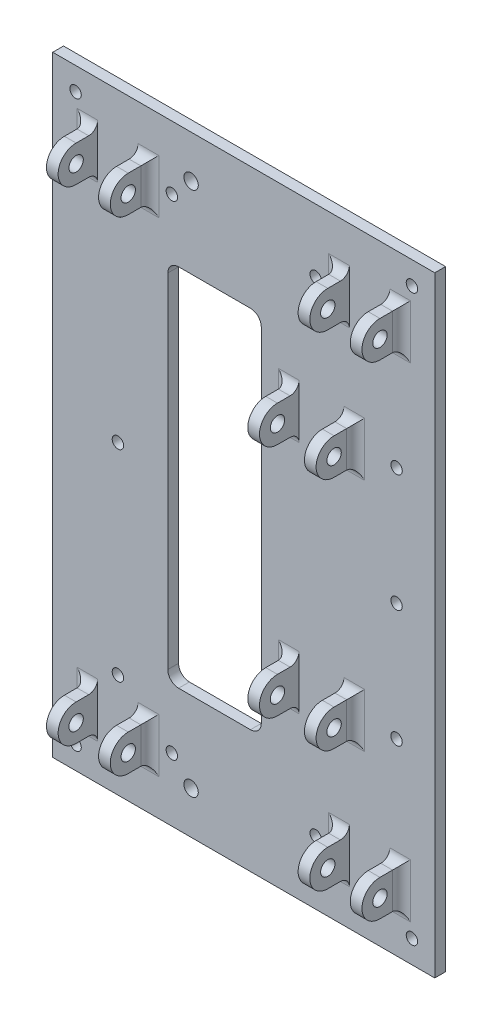
from build123d import *

# Parameters (mm, degrees)
SKETCH1_W               = 212.5
SKETCH1_H               = 339.725
BOSS_EXTRUDE1_DEPTH     = 6
SKETCH2_W               = 6.5
SKETCH2_H               = 20
BOSS_EXTRUDE2_DEPTH     = 24
CUT_EXTRUDE1_DEPTH      = 393.36344838
CUT_EXTRUDE1_DEPTH_BACK = 393.36344838
SKETCH3_R               = 4
FILLET2_R               = 5
SKETCH5_R               = 3.175
CUT_EXTRUDE2_DEPTH      = 402.314497153
CUT_EXTRUDE3_DEPTH      = 402.314497153
SKETCH10_R              = 4
CUT_EXTRUDE4_DEPTH      = 18
SKETCH11_R              = 4
CUT_EXTRUDE5_DEPTH      = 14.986


with BuildPart() as part:
    # Sketch1 → Boss-Extrude1 (new body)
    with BuildSketch(Plane.XY):
        with Locations((106.25, -169.8625)):
            Rectangle(SKETCH1_W, SKETCH1_H)
    extrude(amount=BOSS_EXTRUDE1_DEPTH)

    # Sketch2 → Boss-Extrude2 (add)
    with BuildSketch(Plane.XY.offset(6)):
        with Locations((21.75, -35.2425)):
            Rectangle(SKETCH2_W, SKETCH2_H)
        with Locations((50.75, -35.2425)):
            Rectangle(SKETCH2_W, SKETCH2_H)
        with Locations((161.75, -35.2425)):
            Rectangle(SKETCH2_W, SKETCH2_H)
        with Locations((190.75, -35.2425)):
            Rectangle(SKETCH2_W, SKETCH2_H)
        with Locations((133.75, -104.5325)):
            Rectangle(SKETCH2_W, SKETCH2_H)
        with Locations((165.25, -104.5325)):
            Rectangle(SKETCH2_W, SKETCH2_H)
        with Locations((165.25, -235.1925)):
            Rectangle(SKETCH2_W, SKETCH2_H)
        with Locations((21.75, -304.4825)):
            Rectangle(SKETCH2_W, SKETCH2_H)
        with Locations((50.75, -304.4825)):
            Rectangle(SKETCH2_W, SKETCH2_H)
        with Locations((190.75, -304.4825)):
            Rectangle(SKETCH2_W, SKETCH2_H)
        with Locations((161.75, -304.4825)):
            Rectangle(SKETCH2_W, SKETCH2_H)
        with Locations((133.75, -235.1925)):
            Rectangle(SKETCH2_W, SKETCH2_H)
    extrude(amount=BOSS_EXTRUDE2_DEPTH)

    # Sketch3 → Cut-Extrude1 (cut, two sides: drawn at the far end of the back side and taken through both)
    with BuildSketch(Plane.ZY.offset(-18.5).offset(-CUT_EXTRUDE1_DEPTH_BACK)):
        with Locations((18, -35.2425)):
            Circle(SKETCH3_R)
        with Locations((18, -235.1925)):
            Circle(SKETCH3_R)
        with Locations((18, -304.4825)):
            Circle(SKETCH3_R)
        with Locations((18, -104.5325)):
            Circle(SKETCH3_R)
        with BuildLine():
            Line((18, -25.2425), (18, -12.982943413))
            Line((18, -12.982943413), (51.949532367, -12.982943413))
            Line((51.949532367, -12.982943413), (51.949532367, -57.481006387))
            Line((51.949532367, -57.481006387), (18, -57.481006387))
            Line((18, -57.481006387), (18, -45.2425))
            ThreePointArc((18, -45.2425), (28, -35.2425), (18, -25.2425))
        make_face()
        with BuildLine():
            Line((52.442304634, -132.399123951), (18, -132.399123951))
            Line((18, -132.399123951), (18, -114.5325))
            ThreePointArc((18, -114.5325), (28, -104.5325), (18, -94.5325))
            Line((18, -94.5325), (18, -71.59149594))
            Line((18, -71.59149594), (52.442304634, -71.59149594))
            Line((52.442304634, -71.59149594), (52.442304634, -132.399123951))
        make_face()
        with BuildLine():
            Line((52.599532243, -270.375386727), (18, -270.375386727))
            Line((18, -270.375386727), (18, -245.1925))
            ThreePointArc((18, -245.1925), (28, -235.1925), (18, -225.1925))
            Line((18, -225.1925), (18, -207.306351849))
            Line((18, -207.306351849), (52.599532243, -207.306351849))
            Line((52.599532243, -207.306351849), (52.599532243, -270.375386727))
        make_face()
        with BuildLine():
            Line((52.621034016, -326.721115515), (18, -326.721115515))
            Line((18, -326.721115515), (18, -314.4825))
            ThreePointArc((18, -314.4825), (28, -304.4825), (18, -294.4825))
            Line((18, -294.4825), (18, -282.222834285))
            Line((18, -282.222834285), (52.621034016, -282.222834285))
            Line((52.621034016, -282.222834285), (52.621034016, -326.721115515))
        make_face()
    extrude(amount=CUT_EXTRUDE1_DEPTH + CUT_EXTRUDE1_DEPTH_BACK, mode=Mode.SUBTRACT)

    # Fillet2
    fillet2_edges = [part.edges().sort_by_distance(p)[0] for p in [
        (158.5, -304.4825, 6),
        (18.5, -304.4825, 6),
        (21.75, -45.2425, 6),
        (18.5, -35.2425, 6),
        (21.75, -25.2425, 6),
        (50.75, -25.2425, 6),
        (50.75, -45.2425, 6),
        (54, -35.2425, 6),
        (161.75, -25.2425, 6),
        (190.75, -25.2425, 6),
        (194, -35.2425, 6),
        (190.75, -45.2425, 6),
        (161.75, -45.2425, 6),
        (158.5, -35.2425, 6),
        (168.5, -104.5325, 6),
        (165.25, -114.5325, 6),
        (133.75, -114.5325, 6),
        (130.5, -104.5325, 6),
        (165.25, -94.5325, 6),
        (133.75, -94.5325, 6),
        (21.75, -294.4825, 6),
        (50.75, -294.4825, 6),
        (54, -304.4825, 6),
        (194, -304.4825, 6),
        (161.75, -294.4825, 6),
        (190.75, -294.4825, 6),
        (190.75, -314.4825, 6),
        (161.75, -314.4825, 6),
        (50.75, -314.4825, 6),
        (21.75, -314.4825, 6),
        (165.25, -225.1925, 6),
        (133.75, -225.1925, 6),
        (130.5, -235.1925, 6),
        (133.75, -245.1925, 6),
        (165.25, -245.1925, 6),
        (168.5, -235.1925, 6),
    ]]
    fillet(fillet2_edges, radius=FILLET2_R)

    # Sketch5 → Cut-Extrude2 (cut, through all)
    with BuildSketch(Plane.XY.offset(6)):
        with Locations((12.7, -12.7)):
            Circle(SKETCH5_R)
        with Locations((199.8, -12.7)):
            Circle(SKETCH5_R)
        with Locations((66.25, -35.2425)):
            Circle(SKETCH5_R)
        with Locations((146.25, -35.2425)):
            Circle(SKETCH5_R)
        with Locations((176.25, -57.8625)):
            Circle(SKETCH5_R)
        with Locations((36.25, -57.8625)):
            Circle(SKETCH5_R)
        with Locations((191.25, -104.5325)):
            Circle(SKETCH5_R)
        with Locations((36.25, -169.8625)):
            Circle(SKETCH5_R)
        with Locations((191.25, -169.8625)):
            Circle(SKETCH5_R)
        with Locations((36.25, -281.8625)):
            Circle(SKETCH5_R)
        with Locations((66.25, -304.4825)):
            Circle(SKETCH5_R)
        with Locations((12.7, -327.025)):
            Circle(SKETCH5_R)
        with Locations((199.8, -327.025)):
            Circle(SKETCH5_R)
        with Locations((146.25, -304.4825)):
            Circle(SKETCH5_R)
        with Locations((191.25, -235.1925)):
            Circle(SKETCH5_R)
    extrude(amount=-CUT_EXTRUDE2_DEPTH, mode=Mode.SUBTRACT)

    # Sketch9 → Cut-Extrude3 (cut, through all)
    with BuildSketch(Plane.XY.offset(6)):
        with BuildLine():
            ThreePointArc((64, -265.3625), (65.757359313, -269.605140687), (70, -271.3625))
            Line((70, -271.3625), (110, -271.3625))
            ThreePointArc((110, -271.3625), (114.242640687, -269.605140687), (116, -265.3625))
            Line((116, -265.3625), (116, -74.3625))
            ThreePointArc((116, -74.3625), (114.242640687, -70.119859313), (110, -68.3625))
            Line((110, -68.3625), (70, -68.3625))
            ThreePointArc((70, -68.3625), (65.757359313, -70.119859313), (64, -74.3625))
            Line((64, -74.3625), (64, -265.3625))
        make_face()
    extrude(amount=-CUT_EXTRUDE3_DEPTH, mode=Mode.SUBTRACT)

    # Sketch10 → Cut-Extrude4 (cut)
    with BuildSketch(Plane.XY.offset(6)):
        with Locations((76.95, -316.111459893)):
            Circle(SKETCH10_R)
    extrude(amount=-CUT_EXTRUDE4_DEPTH, mode=Mode.SUBTRACT)

    # Sketch11 → Cut-Extrude5 (cut)
    with BuildSketch(Plane.XY.offset(6)):
        with Locations((76.9625, -23.613540107)):
            Circle(SKETCH11_R)
    extrude(amount=-CUT_EXTRUDE5_DEPTH, mode=Mode.SUBTRACT)


solid = part.part
